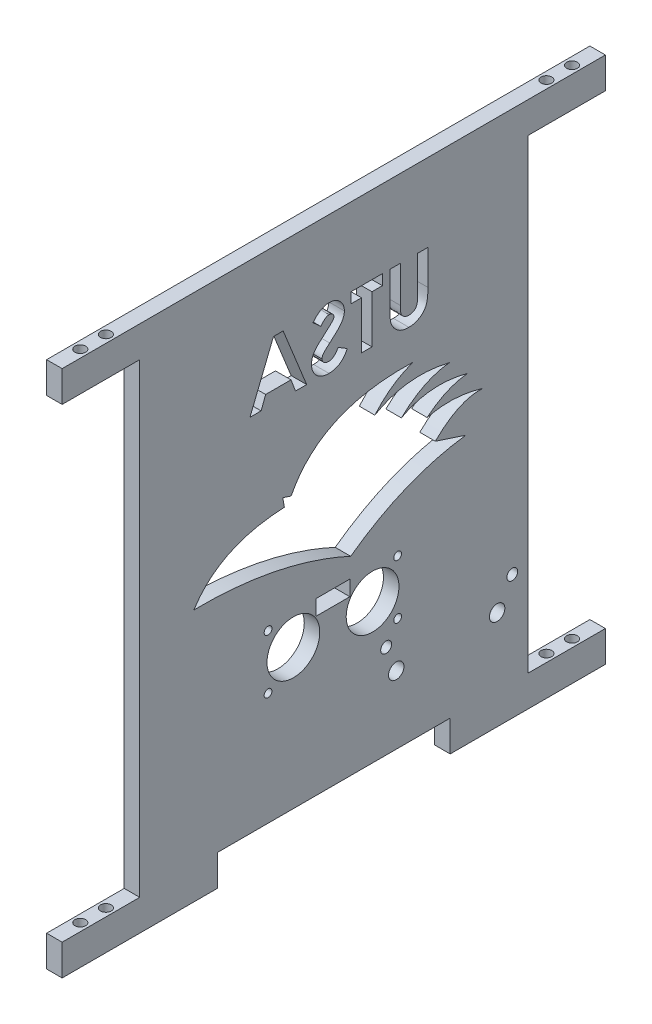
from build123d import *

# Parameters (mm, degrees)
BOSS_EXTRUDE1_DEPTH     = 5.08
SKETCH2_W               = 76.2
SKETCH2_H               = 10.16
CUT_EXTRUDE3_DEPTH      = 22.86
CUT_EXTRUDE5_DEPTH      = 22.86
CUT_EXTRUDE7_DEPTH      = 38.862
CUT_EXTRUDE8_DEPTH      = 152.4
CUT_EXTRUDE8_DEPTH_BACK = 119.38
SKETCH7_R               = 1.7526
SKETCH8_R               = 8.636
CUT_EXTRUDE9_DEPTH      = 119.38
SKETCH9_R               = 1.27
CUT_EXTRUDE10_DEPTH     = 119.38
SKETCH13_W              = 11.0236
SKETCH13_H              = 5.0038
CUT_EXTRUDE11_DEPTH     = 14.478
SKETCH14_R              = 2.523842773
CUT_EXTRUDE12_DEPTH     = 15.494
CUT_EXTRUDE13_DEPTH     = 23.368
SKETCH19_R              = 1.778
CUT_EXTRUDE15_DEPTH     = 31.496


with BuildPart() as part:
    # Sketch1 → Boss-Extrude1 (new body)
    with BuildSketch(Plane(origin=(0, 0, 0), x_dir=(0, 0, -1), z_dir=(1, 0, 0))):
        Polygon((62.997029703, -55.82970297), (88.397029703, -55.82970297), (88.397029703, -65.98970297), (-89.402970297, -65.98970297), (-89.402970297, -55.82970297), (-64.002970297, -55.82970297), (-64.002970297, 96.57029703), (-89.402970297, 96.57029703), (-89.402970297, 106.73029703), (88.397029703, 106.73029703), (88.397029703, 96.57029703), (62.997029703, 96.57029703), align=None)
    extrude(amount=BOSS_EXTRUDE1_DEPTH)

    # Sketch2 → Cut-Extrude3 (cut)
    with BuildSketch(Plane(origin=(0, 0, 0), x_dir=(0, 0, -1), z_dir=(1, 0, 0))):
        with Locations((-0.502970297, -60.90970297)):
            Rectangle(SKETCH2_W, SKETCH2_H)
    extrude(amount=CUT_EXTRUDE3_DEPTH, mode=Mode.SUBTRACT)

    # Sketch5 → Cut-Extrude5 (cut)
    with BuildSketch(Plane(origin=(0, 0, 0), x_dir=(0, 0, -1), z_dir=(1, 0, 0))):
        with BuildLine():
            Line((42.67152563, 21.798812323), (32.727683901, 25.075760165))
            add(Edge.make_bspline(
                [(32.727683901, 25.075760165), (40.594547955, 32.834003648), (48.310135884, 32.271485635)],
                knots=[0, 0, 0, 0.556457518, 0.556457518, 0.556457518], degree=2))
            add(Edge.make_bspline(
                [(48.310135884, 32.271485635), (38.846329971, 35.253051739), (30.043722925, 33.142321761)],
                knots=[0, 0, 0, 0.798456782, 0.798456782, 0.798456782], degree=2))
            add(Edge.make_bspline(
                [(30.043722925, 33.142321761), (36.636187457, 38.528637892), (43.403293417, 39.011266024)],
                knots=[0, 0, 0, 0.45519868, 0.45519868, 0.45519868], degree=2))
            add(Edge.make_bspline(
                [(43.403293417, 39.011266024), (31.0594664, 42.377187899), (21.626421286, 37.235138155)],
                knots=[0, 0, 0, 0.837450312, 0.837450312, 0.837450312], degree=2))
            add(Edge.make_bspline(
                [(21.626421286, 37.235138155), (28.918292117, 44.241112492), (37.379903253, 45.034656188)],
                knots=[0, 0, 0, 0.665456302, 0.665456302, 0.665456302], degree=2))
            add(Edge.make_bspline(
                [(37.379903253, 45.034656188), (23.39004977, 48.465923097), (12.940554793, 42.363637684)],
                knots=[0, 0, 0, 0.846898376, 0.846898376, 0.846898376], degree=2))
            add(Edge.make_bspline(
                [(12.940554793, 42.363637684), (18.48774971, 48.849569759), (25.642014728, 51.138135058)],
                knots=[0, 0, 0, 0.615209655, 0.615209655, 0.615209655], degree=2))
            add(Edge.make_bspline(
                [(25.642014728, 51.138135058), (-4.773758181, 52.154358878), (-14.451137011, 33.142321761)],
                knots=[0, 0, 0, 0.882310841, 0.882310841, 0.882310841], degree=2))
            Line((-14.451137011, 33.142321761), (-17.197936189, 34.046940172))
            Line((-17.197936189, 34.046940172), (-16.663836349, 31.046166517))
            add(Edge.make_bspline(
                [(-16.663836349, 31.046166517), (-37.817175071, 30.181842577), (-46.27141975, 16.762309867)],
                knots=[0, 0, 0, 0.810821066, 0.810821066, 0.810821066], degree=2))
            add(Edge.make_bspline(
                [(-46.27141975, 16.762309867), (-18.353483266, 17.125651082), (5.043124539, 6.31805872)],
                knots=[0, 0, 0, 0.629594305, 0.629594305, 0.629594305], degree=2))
            add(Edge.make_bspline(
                [(5.043124539, 6.31805872), (22.677293365, 19.166653929), (42.67152563, 21.798812323)],
                knots=[0, 0, 0, 0.79265434, 0.79265434, 0.79265434], degree=2))
        make_face()
    extrude(amount=CUT_EXTRUDE5_DEPTH, mode=Mode.SUBTRACT)

    # Sketch6 → Cut-Extrude7 (cut)
    # profile 1 of 4: a face of its own
    with BuildSketch(Plane(origin=(0, 0, 0), x_dir=(0, 0, -1), z_dir=(1, 0, 0))):
        with BuildLine():
            Line((30.31895278, 81.243055873), (26.899722011, 81.243055873))
            Line((26.899722011, 81.243055873), (26.899722011, 68.848344335))
            add(Edge.make_bspline(
                [(26.899722011, 68.848344335), (26.89953609, 68.719841341), (26.899176985, 68.471639138), (26.881200037, 68.115550237), (26.864749889, 67.788229981), (26.835069153, 67.490036714), (26.791220533, 67.220842881), (26.748760761, 66.978919274), (26.691295658, 66.768597264), (26.604934795, 66.529195753), (26.471881056, 66.260215079), (26.254478628, 65.97987725), (26.003614824, 65.724028292), (25.702940107, 65.511069312), (25.365008315, 65.338804693), (24.991676234, 65.211175674), (24.583470129, 65.140230885), (24.301218, 65.129399864), (24.155941963, 65.123825104)],
                knots=[0, 0, 0, 0, 1.155499968, 2.231836252, 3.205919964, 4.102923608, 4.924856345, 5.658536265, 6.31071849, 6.882491295, 7.94666036, 8.992281882, 10.060072772, 11.158554251, 12.289267114, 13.461410017, 14.693379945, 16, 16, 16, 16], degree=3))
            add(Edge.make_bspline(
                [(24.155941963, 65.123825104), (24.001604101, 65.128328794), (23.700671401, 65.137110228), (23.267827619, 65.223309508), (22.8667954, 65.360568282), (22.506065965, 65.556471534), (22.185998296, 65.791295914), (21.915067721, 66.059069295), (21.701250307, 66.36032575), (21.561892071, 66.63825777), (21.483649284, 66.894069992), (21.425002418, 67.122628505), (21.382007777, 67.392304926), (21.343001626, 67.698887677), (21.319561934, 68.045552365), (21.294145409, 68.429511066), (21.284830017, 68.853390929), (21.283242276, 69.148546434), (21.282414318, 69.302460921)],
                knots=[0, 0, 0, 0, 1.261321664, 2.459363699, 3.594844139, 4.716940403, 5.803436589, 6.833651888, 7.818396249, 8.814403945, 9.360733334, 10.004355033, 10.743453831, 11.592799886, 12.532235708, 13.585170094, 14.740740724, 16, 16, 16, 16], degree=3))
            Line((21.282414318, 69.302460921), (21.282414318, 81.243055873))
            Line((21.282414318, 81.243055873), (17.863183549, 81.243055873))
            Line((17.863183549, 81.243055873), (17.863183549, 69.878692892))
            add(Edge.make_bspline(
                [(17.863183549, 69.878692892), (17.863658371, 69.648451442), (17.864571409, 69.205719586), (17.878592905, 68.569482754), (17.908442135, 67.988382465), (17.933512045, 67.462248923), (17.982030906, 66.991790916), (18.032576177, 66.574999455), (18.097000474, 66.213351555), (18.192859954, 65.80165937), (18.358285037, 65.327610896), (18.624971959, 64.781764629), (18.963513746, 64.247348069), (19.363653219, 63.730240169), (19.815447286, 63.249863594), (20.308878705, 62.82815514), (20.836108077, 62.471435263), (21.402644573, 62.188426193), (22.00800604, 61.967700453), (22.658182078, 61.819383873), (23.352729318, 61.71917933), (23.832466225, 61.709553451), (24.079619847, 61.704594335)],
                knots=[0, 0, 0, 0, 1.170808336, 2.251350247, 3.235597562, 4.129743112, 4.929140599, 5.639994148, 6.264258765, 6.79612947, 7.788252245, 8.809469599, 9.879094798, 10.999557536, 12.129761673, 13.226370002, 14.293821979, 15.358369427, 16.438775801, 17.562147481, 18.744053101, 20, 20, 20, 20], degree=3))
            add(Edge.make_bspline(
                [(24.079619847, 61.704594335), (24.243833631, 61.707360299), (24.567824057, 61.71281749), (25.044308816, 61.760935658), (25.504924935, 61.831843745), (25.948806921, 61.935291342), (26.377495403, 62.068926315), (26.790876491, 62.233421661), (27.187413959, 62.427859845), (27.56488884, 62.650452457), (27.922836619, 62.891148048), (28.249982412, 63.157969243), (28.557584074, 63.431183607), (28.836755121, 63.722289159), (29.089592376, 64.028229789), (29.31557512, 64.349698858), (29.51436762, 64.686667812), (29.690970389, 65.045210496), (29.842125124, 65.44355034), (29.969554244, 65.895856458), (30.080879321, 66.409218295), (30.16360955, 66.984792429), (30.238613261, 67.620681831), (30.286086475, 68.318543091), (30.310921851, 69.07839623), (30.316208161, 69.605186659), (30.31895278, 69.878692892)],
                knots=[0, 0, 0, 0, 1.001158378, 1.975264943, 2.917723546, 3.841610987, 4.75185031, 5.653588123, 6.552117133, 7.442167995, 8.324307438, 9.179605724, 10.014504199, 10.831958861, 11.636465792, 12.43274043, 13.225645099, 14.020104002, 14.867201867, 15.819789774, 16.883317127, 18.068162734, 19.364263498, 20.787406516, 22.332041935, 24, 24, 24, 24], degree=3))
            Line((30.31895278, 69.878692892), (30.31895278, 81.243055873))
        make_face()
    # profile 2 of 4: a face of its own
    with BuildSketch(Plane(origin=(0, 0, 0), x_dir=(0, 0, -1), z_dir=(1, 0, 0))):
        Polygon((15.420875857, 81.243055873), (5.163183549, 81.243055873), (5.163183549, 77.823825104), (8.582414318, 77.823825104), (8.582414318, 62.193055873), (12.001645088, 62.193055873), (12.001645088, 77.823825104), (15.420875857, 77.823825104), align=None)
    # profile 3 of 4: a face of its own
    with BuildSketch(Plane(origin=(0, 0, 0), x_dir=(0, 0, -1), z_dir=(1, 0, 0))):
        with BuildLine():
            Line((-7.292585682, 78.697713325), (-4.735794816, 76.358440488))
            add(Edge.make_bspline(
                [(-4.735794816, 76.358440488), (-4.626272859, 76.512932595), (-4.416005974, 76.809535896), (-4.075185285, 77.206694706), (-3.735903576, 77.545500728), (-3.395017609, 77.824538585), (-3.0495059, 78.042112916), (-2.699968206, 78.196157946), (-2.348386155, 78.294085834), (-2.112177289, 78.306280212), (-1.995830874, 78.312286642)],
                knots=[0, 0, 0, 0, 1.299362458, 2.494594718, 3.587462134, 4.587049575, 5.512617175, 6.380583204, 7.202344345, 8, 8, 8, 8], degree=3))
            add(Edge.make_bspline(
                [(-1.995830874, 78.312286642), (-1.887306276, 78.308480692), (-1.677773789, 78.301132403), (-1.379069684, 78.228090953), (-1.113875926, 78.102032137), (-0.882451332, 77.937199631), (-0.69912891, 77.738614675), (-0.552760172, 77.530350117), (-0.470342273, 77.300473144), (-0.459494456, 77.142584367), (-0.454124143, 77.064420056)],
                knots=[0, 0, 0, 0, 1.185010067, 2.2879431, 3.333075148, 4.379039566, 5.372662701, 6.27520591, 7.14612461, 8, 8, 8, 8], degree=3))
            add(Edge.make_bspline(
                [(-0.454124143, 77.064420056), (-0.457489446, 76.985128581), (-0.464266698, 76.825446569), (-0.529725731, 76.591412694), (-0.628391183, 76.362734355), (-0.722670052, 76.223526968), (-0.770860922, 76.152370777)],
                knots=[0, 0, 0, 0, 0.967525499, 1.948461899, 2.951351359, 4, 4, 4, 4], degree=3))
            add(Edge.make_bspline(
                [(-0.770860922, 76.152370777), (-0.814671636, 76.097061814), (-0.915518115, 75.969747887), (-1.107811695, 75.768102471), (-1.349292047, 75.521069187), (-1.649251842, 75.237142784), (-1.995238925, 74.90611216), (-2.403290244, 74.540990253), (-2.861660303, 74.130469664), (-3.187459121, 73.844597991), (-3.358180634, 73.694798662)],
                knots=[0, 0, 0, 0, 0.473873513, 1.090794244, 1.870441696, 2.795289791, 3.865433203, 5.087734844, 6.473946851, 8, 8, 8, 8], degree=3))
            add(Edge.make_bspline(
                [(-3.358180634, 73.694798662), (-3.518427331, 73.556113228), (-3.822542271, 73.292917087), (-4.255237438, 72.919352425), (-4.635504425, 72.583265406), (-4.968882855, 72.289699979), (-5.250319035, 72.03557597), (-5.480996125, 71.819678669), (-5.663731453, 71.6462112), (-5.767605788, 71.541436743), (-5.811936643, 71.496721738)],
                knots=[0, 0, 0, 0, 1.543621617, 2.929473131, 4.163658386, 5.240097082, 6.164993805, 6.925417477, 7.541396219, 8, 8, 8, 8], degree=3))
            add(Edge.make_bspline(
                [(-5.811936643, 71.496721738), (-5.980118667, 71.314712769), (-6.30342358, 70.964827611), (-6.723605995, 70.422615653), (-7.069429714, 69.893306223), (-7.336965501, 69.366939505), (-7.539019287, 68.835921075), (-7.681469883, 68.287227735), (-7.766784493, 67.715125983), (-7.776256407, 67.324736378), (-7.78104722, 67.127280633)],
                knots=[0, 0, 0, 0, 1.206664779, 2.319633467, 3.337109185, 4.282041471, 5.190008762, 6.099243693, 7.03861361, 8, 8, 8, 8], degree=3))
            add(Edge.make_bspline(
                [(-7.78104722, 67.127280633), (-7.777637242, 66.934884225), (-7.770946737, 66.557395311), (-7.689000889, 66.004996516), (-7.572150919, 65.476326894), (-7.391480367, 64.977139119), (-7.171280167, 64.499239175), (-6.895227414, 64.050071225), (-6.571041308, 63.625089504), (-6.199474253, 63.231891081), (-5.78847697, 62.875090766), (-5.347643323, 62.557458698), (-4.872662619, 62.295212966), (-4.367593019, 62.079272313), (-3.832704874, 61.912951934), (-3.268635398, 61.790025673), (-2.674521808, 61.716247268), (-2.268258374, 61.708534612), (-2.060704672, 61.704594335)],
                knots=[0, 0, 0, 0, 1.043214005, 2.046824704, 3.02475056, 3.976699089, 4.921714032, 5.875962561, 6.831408892, 7.817874052, 8.806269674, 9.781291748, 10.760897367, 11.74438705, 12.757449933, 13.795994037, 14.874007457, 16, 16, 16, 16], degree=3))
            add(Edge.make_bspline(
                [(-2.060704672, 61.704594335), (-1.897776783, 61.707484784), (-1.575086124, 61.713209531), (-1.099488878, 61.759947328), (-0.640245974, 61.835377158), (-0.197874707, 61.943490638), (0.229617882, 62.080485081), (0.642249351, 62.247818544), (1.037171168, 62.448084635), (1.417371497, 62.677165085), (1.781002097, 62.943157664), (2.132660932, 63.240624239), (2.468854995, 63.57413998), (2.791198956, 63.942916134), (3.09763037, 64.347996988), (3.398179835, 64.783741041), (3.679490029, 65.258235111), (3.85326785, 65.591096539), (3.942029703, 65.761114767)],
                knots=[0, 0, 0, 0, 1.016823716, 2.013894106, 2.979844003, 3.91962641, 4.853723003, 5.779685073, 6.695824784, 7.614987388, 8.547259901, 9.504950863, 10.487499108, 11.500346958, 12.559593716, 13.656357062, 14.802919212, 16, 16, 16, 16], degree=3))
            Line((3.942029703, 65.761114767), (0.934938357, 67.566132796))
            add(Edge.make_bspline(
                [(0.934938357, 67.566132796), (0.823910545, 67.373139892), (0.61106074, 67.003156002), (0.250366846, 66.506035752), (-0.119145633, 66.080334547), (-0.506019497, 65.733576682), (-0.905550503, 65.46112556), (-1.319668479, 65.266413086), (-1.748664376, 65.145886285), (-2.040876893, 65.131167179), (-2.186636162, 65.123825104)],
                knots=[0, 0, 0, 0, 1.283663364, 2.460892379, 3.537111102, 4.529833553, 5.449777664, 6.316464042, 7.160231139, 8, 8, 8, 8], degree=3))
            add(Edge.make_bspline(
                [(-2.186636162, 65.123825104), (-2.334894208, 65.12982104), (-2.622536408, 65.14145403), (-3.033108841, 65.248904451), (-3.409537193, 65.417609494), (-3.734919081, 65.658328327), (-4.010431948, 65.936154447), (-4.213776259, 66.245248708), (-4.341518526, 66.579681238), (-4.355023981, 66.812000072), (-4.361816451, 66.928843133)],
                knots=[0, 0, 0, 0, 1.13588714, 2.203786484, 3.234766741, 4.283437687, 5.291419208, 6.222934724, 7.106237994, 8, 8, 8, 8], degree=3))
            add(Edge.make_bspline(
                [(-4.361816451, 66.928843133), (-4.355543883, 67.037546587), (-4.342801762, 67.258367249), (-4.248947224, 67.586692063), (-4.102223955, 67.914867563), (-3.928639981, 68.184045987), (-3.751996551, 68.409421784), (-3.583085591, 68.604699717), (-3.377396724, 68.820447646), (-3.135451485, 69.056936966), (-2.860446604, 69.316249552), (-2.552150424, 69.598360011), (-2.207032628, 69.900783288), (-1.963102689, 70.106791036), (-1.835554432, 70.2145102)],
                knots=[0, 0, 0, 0, 0.916159276, 1.861089862, 2.860218735, 3.940849679, 4.552606315, 5.27541173, 6.11797699, 7.06649574, 8.129236253, 9.306560635, 10.591630461, 12, 12, 12, 12], degree=3))
            add(Edge.make_bspline(
                [(-1.835554432, 70.2145102), (-1.593080119, 70.41966672), (-1.12769852, 70.813424179), (-0.470055278, 71.39499155), (0.122540168, 71.938519547), (0.644969527, 72.450727363), (1.103889357, 72.922155708), (1.496191654, 73.356633703), (1.817566798, 73.757512752), (2.15574484, 74.232327158), (2.477081594, 74.810921138), (2.754807737, 75.50703677), (2.934984737, 76.203064075), (2.955171064, 76.670338471), (2.965106626, 76.900327508)],
                knots=[0, 0, 0, 0, 1.345494975, 2.582412109, 3.71882943, 4.751509156, 5.681369928, 6.505683931, 7.230279997, 7.856715994, 8.973648664, 10.023341002, 11.027102913, 12, 12, 12, 12], degree=3))
            add(Edge.make_bspline(
                [(2.965106626, 76.900327508), (2.960974439, 77.063423388), (2.952833586, 77.384739792), (2.880215926, 77.857188747), (2.771686067, 78.313062291), (2.614069552, 78.750697192), (2.409502348, 79.169545292), (2.161063425, 79.57165703), (1.864894996, 79.95333146), (1.531133172, 80.31431556), (1.163413094, 80.644213947), (0.77045746, 80.935382329), (0.354490434, 81.181307379), (-0.081943308, 81.385320065), (-0.541548166, 81.541478816), (-1.02093825, 81.652171922), (-1.520801159, 81.718008652), (-1.86079712, 81.726958391), (-2.033991932, 81.731517412)],
                knots=[0, 0, 0, 0, 1.010766082, 1.991317756, 2.957454644, 3.913069143, 4.869106762, 5.843196583, 6.838735724, 7.860187025, 8.887984031, 9.89767229, 10.887916223, 11.879572884, 12.879850636, 13.892031539, 14.926195476, 16, 16, 16, 16], degree=3))
            add(Edge.make_bspline(
                [(-2.033991932, 81.731517412), (-2.258443836, 81.723306483), (-2.705575899, 81.706949439), (-3.36667355, 81.579042704), (-4.012406096, 81.37789589), (-4.532749483, 81.135234389), (-4.946777003, 80.900168078), (-5.264090422, 80.683748629), (-5.586973906, 80.435828519), (-5.918031309, 80.155626486), (-6.251111073, 79.837863155), (-6.595684247, 79.490103133), (-6.947055602, 79.109340959), (-7.175391272, 78.837326228), (-7.292585682, 78.697713325)],
                knots=[0, 0, 0, 0, 1.282922637, 2.555718331, 3.837320111, 5.142675274, 5.830281639, 6.55870424, 7.337177975, 8.157850921, 9.037902056, 9.96903443, 10.957596896, 12, 12, 12, 12], degree=3))
        make_face()
    # profile 4 of 4: a face of its own
    with BuildSketch(Plane(origin=(0, 0, 0), x_dir=(0, 0, -1), z_dir=(1, 0, 0))):
        Polygon((-17.065632557, 81.243055873), (-20.236816451, 81.243055873), (-27.930085682, 62.193055873), (-24.27807246, 62.193055873), (-22.797423422, 66.100748181), (-14.497393374, 66.100748181), (-13.016744335, 62.193055873), (-9.36854722, 62.193055873), align=None)
        Polygon((-18.649316451, 76.133290248), (-15.794869335, 69.51997895), (-21.503763566, 69.51997895), align=None, mode=Mode.SUBTRACT)
    extrude(amount=CUT_EXTRUDE7_DEPTH, mode=Mode.SUBTRACT)


with BuildPart() as cut_extrude7_piece_1:
    # of the separate pieces the step leaves, piece 1, a body of its own (cut_extrude7_pieces)
    add(part.part.solids().sort_by_distance((0, -55.82970297, -62.997029703))[0])

    # Sketch7 → Cut-Extrude8 (cut, two sides: drawn at the far end of the back side and taken through both)
    with BuildSketch(Plane(origin=(0, 0, 0), x_dir=(1, 0, 0), z_dir=(0, 1, 0)).offset(-CUT_EXTRUDE8_DEPTH_BACK)):
        with Locations(Location((2.54, 80.015029703, 0), (0, 0, 90))):
            Circle(SKETCH7_R)
        with Locations(Location((2.54, 71.633029703, 0), (0, 0, 90))):
            Circle(SKETCH7_R)
        with Locations(Location((2.54, -72.541277989, 0), (0, 0, 90))):
            Circle(SKETCH7_R)
        with Locations(Location((2.54, -80.923277989, 0), (0, 0, 90))):
            Circle(SKETCH7_R)
    extrude(amount=CUT_EXTRUDE8_DEPTH + CUT_EXTRUDE8_DEPTH_BACK, mode=Mode.SUBTRACT)

    # Sketch8 → Cut-Extrude9 (cut)
    with BuildSketch(Plane(origin=(0, 0, 0), x_dir=(0, 0, -1), z_dir=(1, 0, 0))):
        with Locations(Location((12.197029703, -10.100570128, 0), (0, 0, 180))):
            Circle(SKETCH8_R)
        with Locations(Location((-13.710970297, -10.100570128, 0), (0, 0, 180))):
            Circle(SKETCH8_R)
    extrude(amount=CUT_EXTRUDE9_DEPTH, mode=Mode.SUBTRACT)

    # Sketch9 → Cut-Extrude10 (cut)
    with BuildSketch(Plane(origin=(0, 0, 0), x_dir=(0, 0, -1), z_dir=(1, 0, 0))):
        with Locations(Location((-22.010170297, -1.223907747, 0), (0, 0, 180))):
            Circle(SKETCH9_R)
        with Locations(Location((-22.010170297, -18.977232508, 0), (0, 0, 180))):
            Circle(SKETCH9_R)
        with Locations(Location((20.404229703, -18.977232508, 0), (0, 0, 180))):
            Circle(SKETCH9_R)
        with Locations(Location((20.404229703, -1.223907747, 0), (0, 0, 180))):
            Circle(SKETCH9_R)
    extrude(amount=CUT_EXTRUDE10_DEPTH, mode=Mode.SUBTRACT)

    # Sketch13 → Cut-Extrude11 (cut)
    with BuildSketch(Plane(origin=(0, 0, 0), x_dir=(0, 0, -1), z_dir=(1, 0, 0))):
        with Locations((-0.746414126, -2.5019)):
            Rectangle(SKETCH13_W, SKETCH13_H)
    extrude(amount=CUT_EXTRUDE11_DEPTH, mode=Mode.SUBTRACT)

    # Sketch14 → Cut-Extrude12 (cut)
    with BuildSketch(Plane(origin=(0, 0, 0), x_dir=(0, 0, -1), z_dir=(1, 0, 0))):
        with Locations(Location((19.941494033, -33.601017961, 0), (0, 0, 180))):
            Circle(SKETCH14_R)
        with Locations(Location((52.961494033, -33.601017961, 0), (0, 0, 180))):
            Circle(SKETCH14_R)
    extrude(amount=CUT_EXTRUDE12_DEPTH, mode=Mode.SUBTRACT)

    # Sketch19 → Cut-Extrude15 (cut)
    with BuildSketch(Plane(origin=(0, 0, 0), x_dir=(0, 0, -1), z_dir=(1, 0, 0))):
        with Locations(Location((16.642029703, -25.261894112, 0), (0, 0, 180))):
            Circle(SKETCH19_R)
        with Locations(Location((57.917029703, -25.261894112, 0), (0, 0, 180))):
            Circle(SKETCH19_R)
    extrude(amount=CUT_EXTRUDE15_DEPTH, mode=Mode.SUBTRACT)


with BuildPart() as cut_extrude7_piece_2:
    # of the separate pieces the step leaves, piece 2, a body of its own (cut_extrude7_pieces)
    add(part.part.solids().sort_by_distance((0, 69.51997895, 21.503763566))[0])

    # Sketch18 → Cut-Extrude13 (cut)
    with BuildSketch(Plane(origin=(0, 0, 0), x_dir=(0, 0, -1), z_dir=(1, 0, 0))):
        Polygon((-19.190181441, 77.808466679), (-23.616883518, 68.876014274), (-14.52633461, 68.876014274), align=None)
    extrude(amount=CUT_EXTRUDE13_DEPTH, mode=Mode.SUBTRACT)


solid = cut_extrude7_piece_1.part
